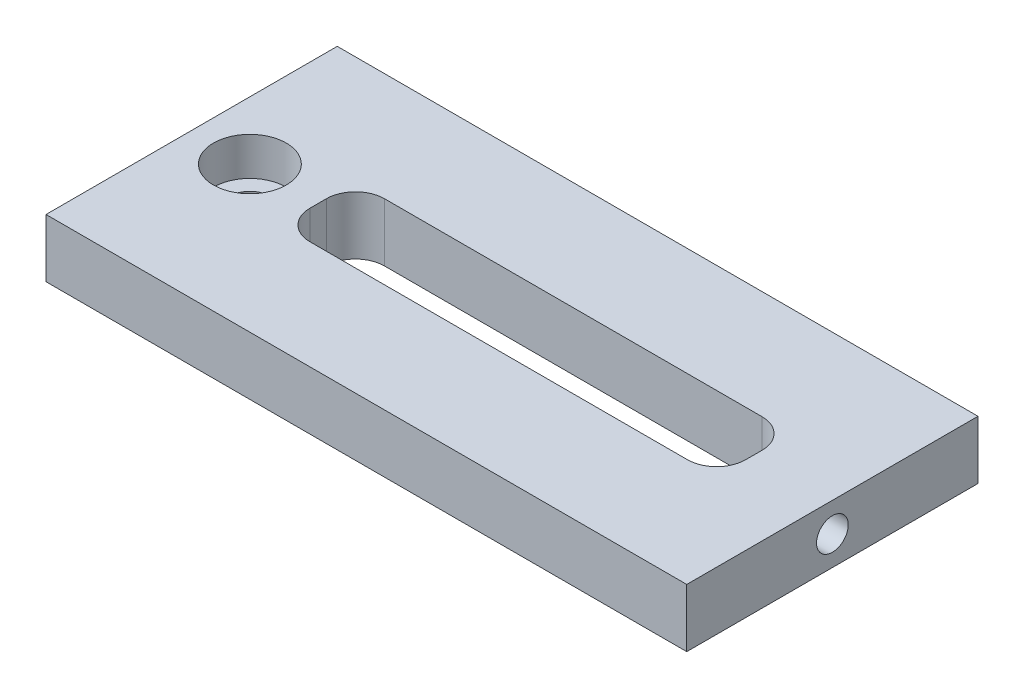
from build123d import *

# Parameters (mm, degrees)
SKETCH1_W                                      = 69.85
SKETCH1_H                                      = 31.75
BOSS_EXTRUDE1_DEPTH                            = 3.175
SKETCH2_W                                      = 47.498
SKETCH2_H                                      = 8.128
CUT_EXTRUDE1_DEPTH                             = 6.35
FILLET1_R                                      = 3.175
CBORE_FOR_8_SOCKET_HEAD_CAP_SCREW1_D           = 4.4958
CBORE_FOR_8_SOCKET_HEAD_CAP_SCREW1_DEPTH       = 16.51
CBORE_FOR_8_SOCKET_HEAD_CAP_SCREW1_CBORE_D     = 7.9375
CBORE_FOR_8_SOCKET_HEAD_CAP_SCREW1_CBORE_DEPTH = 4.1656
CBORE_FOR_8_SOCKET_HEAD_CAP_SCREW1_TIP         = 1.350674586
F_8_32_TAPPED_HOLE1_D                          = 3.4544
F_8_32_TAPPED_HOLE1_DEPTH                      = 8.5598


with BuildPart() as part:
    # Sketch1 → Boss-Extrude1 (new, symmetric)
    with BuildSketch(Plane(origin=(0, 0, 0), x_dir=(1, 0, 0), z_dir=(0, 1, 0))):
        Rectangle(SKETCH1_W, SKETCH1_H)
    extrude(amount=BOSS_EXTRUDE1_DEPTH, both=True)

    # Sketch2 → Cut-Extrude1 (cut)
    with BuildSketch(Plane(origin=(0, 3.175, 0), x_dir=(1, 0, 0), z_dir=(0, 1, 0))):
        with Locations((2.6162, 0)):
            Rectangle(SKETCH2_W, SKETCH2_H)
    extrude(amount=-CUT_EXTRUDE1_DEPTH, mode=Mode.SUBTRACT)

    # Fillet1
    fillet1_edges = [part.edges().sort_by_distance(p)[0] for p in [
        (-21.1328, 0, 4.064),
        (-21.1328, 0, -4.064),
        (26.3652, 0, -4.064),
        (26.3652, 0, 4.064),
    ]]
    fillet(fillet1_edges, radius=FILLET1_R)

    # CBORE for #8 Socket Head Cap Screw1
    with Locations(Plane(origin=(0, 3.175, 0), x_dir=(1, 0, 0), z_dir=(0, 1, 0))):
        with Locations((-28.575, 0)):
            CounterBoreHole(CBORE_FOR_8_SOCKET_HEAD_CAP_SCREW1_D / 2, CBORE_FOR_8_SOCKET_HEAD_CAP_SCREW1_CBORE_D / 2, CBORE_FOR_8_SOCKET_HEAD_CAP_SCREW1_CBORE_DEPTH, depth=CBORE_FOR_8_SOCKET_HEAD_CAP_SCREW1_DEPTH)
            with Locations((0, 0, -(CBORE_FOR_8_SOCKET_HEAD_CAP_SCREW1_DEPTH + CBORE_FOR_8_SOCKET_HEAD_CAP_SCREW1_TIP / 2))):  # 118° drill point
                Cone(0, CBORE_FOR_8_SOCKET_HEAD_CAP_SCREW1_D / 2, CBORE_FOR_8_SOCKET_HEAD_CAP_SCREW1_TIP, mode=Mode.SUBTRACT)

    # #8-32 Tapped Hole1
    with Locations(Plane(origin=(34.925, 0, 0), x_dir=(0, 0, -1), z_dir=(1, 0, 0))):
        with Locations((0, 0)):
            Hole(F_8_32_TAPPED_HOLE1_D / 2, depth=F_8_32_TAPPED_HOLE1_DEPTH)


solid = part.part
